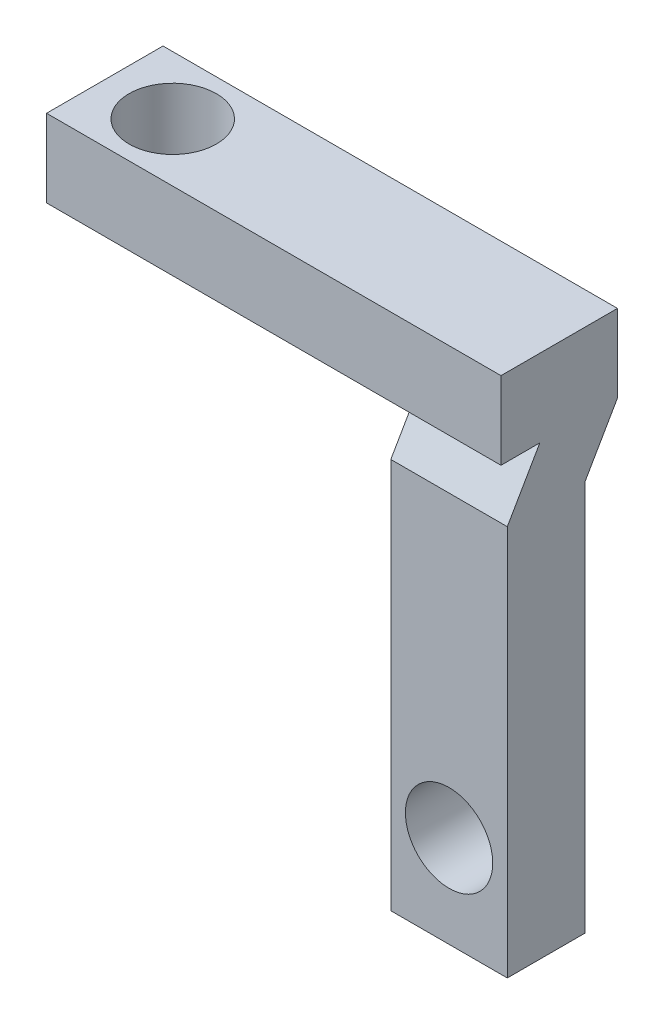
from build123d import *

# Parameters (mm, degrees)
BOSS_EXTRUDE1_DEPTH = 12
BOSS_EXTRUDE2_DEPTH = 46.82
SKETCH3_R           = 4.5
CUT_EXTRUDE2_DEPTH  = 8
SKETCH5_R           = 4.5
CUT_EXTRUDE4_DEPTH  = 8


with BuildPart() as part:
    # Sketch1 → Boss-Extrude1 (new body)
    with BuildSketch(Plane(origin=(0, 0, 0), x_dir=(0, 0, -1), z_dir=(1, 0, 0))):
        Polygon((475.915980223, -8), (483.915980223, -8), (480.565980223, -13.802370205), (480.565980223, -54.069999995), (472.565980223, -54.069999995), (472.565980223, -13.802370205), align=None)
    extrude(amount=-BOSS_EXTRUDE1_DEPTH)

    # Sketch1<3> → Boss-Extrude2 (add)
    with BuildSketch(Plane(origin=(0, 0, 0), x_dir=(0, 0, -1), z_dir=(1, 0, 0))):
        Polygon((471.915980223, -8), (475.915980223, -8), (483.915980223, -8), (483.915980223, 0), (471.915980223, 0), align=None)
    extrude(amount=-BOSS_EXTRUDE2_DEPTH)

    # Sketch3 → Cut-Extrude2 (cut)
    with BuildSketch(Plane.XZ.offset(8)):
        with Locations(Location((-39.82, -477.915980223, 0), (0, 0, 270))):
            Circle(SKETCH3_R)
    extrude(amount=-CUT_EXTRUDE2_DEPTH, mode=Mode.SUBTRACT)

    # Sketch5 → Cut-Extrude4 (cut)
    with BuildSketch(Plane.XY.offset(-472.565980223)):
        with Locations((-6, -44.569999995)):
            Circle(SKETCH5_R)
    extrude(amount=-CUT_EXTRUDE4_DEPTH, mode=Mode.SUBTRACT)


solid = part.part
